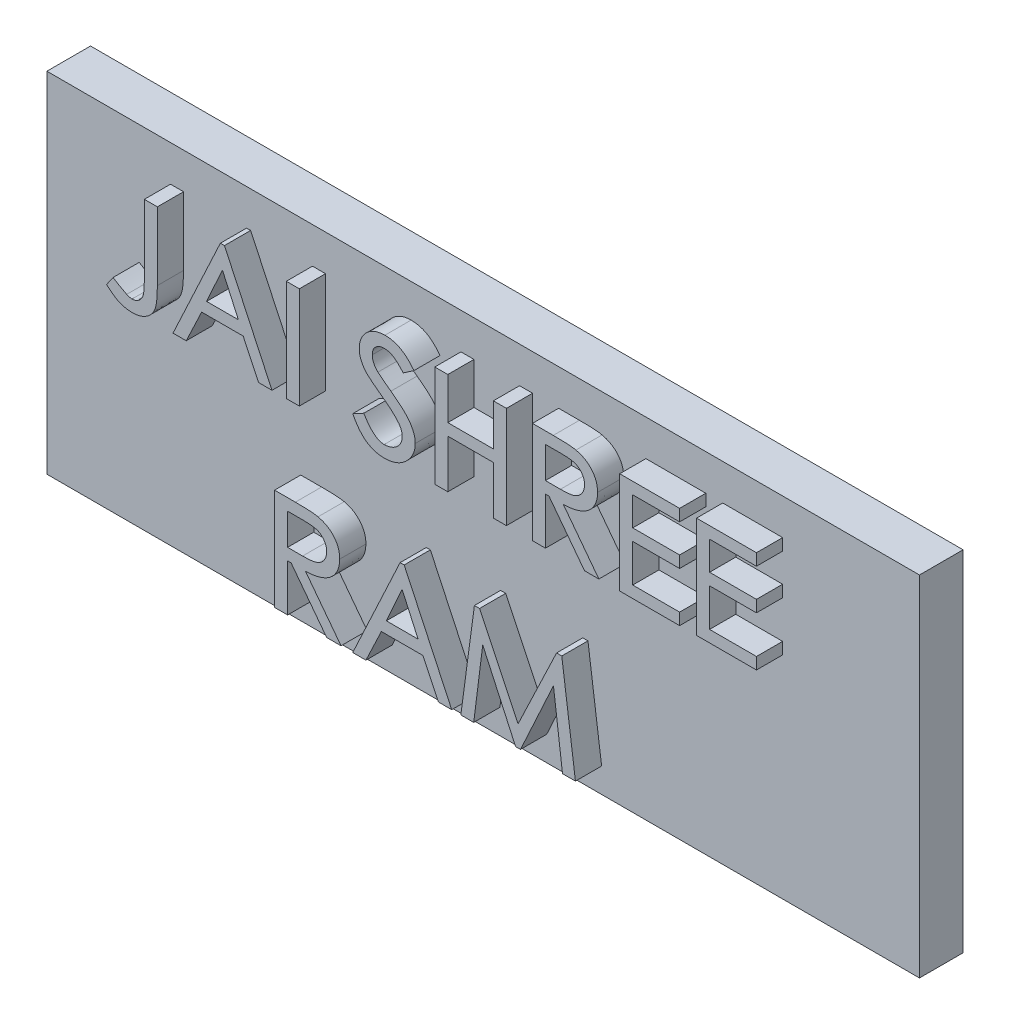
from build123d import *

# Parameters (mm, degrees)
SKETCH1_W           = 50
SKETCH1_H           = 20
BOSS_EXTRUDE4_DEPTH = 2.5
SKETCH3_W           = 0.746260684
SKETCH3_H           = 5.820833333
BOSS_EXTRUDE5_DEPTH = 1.5


with BuildPart() as part:
    # Sketch1 → Boss-Extrude4 (new body)
    with BuildSketch(Plane.XY):
        with Locations((25, 10)):
            Rectangle(SKETCH1_W, SKETCH1_H)
    extrude(amount=BOSS_EXTRUDE4_DEPTH)

    # Sketch3 → Boss-Extrude5 (add)
    # profile 1 of 11: a face of its own
    with BuildSketch(Plane.XY.offset(2.5)):
        with BuildLine():
            Line((7.084742935, 17.934560525), (7.831003619, 17.934560525))
            Line((7.831003619, 17.934560525), (7.831003619, 14.027186226))
            add(Edge.make_bspline(
                [(7.831003619, 14.027186226), (7.830439068, 13.956445674), (7.829353193, 13.820381182), (7.824385638, 13.624356974), (7.812407276, 13.445136284), (7.797069528, 13.281870811), (7.779924351, 13.134469513), (7.754763509, 13.003542974), (7.727850465, 12.888631113), (7.684298502, 12.758299554), (7.615616781, 12.611983995), (7.506225078, 12.454205409), (7.370368081, 12.313654468), (7.238408402, 12.211055476), (7.121050361, 12.140600257), (7.027785467, 12.092003572), (6.928468821, 12.052540147), (6.824004925, 12.021574123), (6.715503014, 11.99561053), (6.601788347, 11.976753661), (6.482875343, 11.966490539), (6.401855443, 11.965154672), (6.360636865, 11.964475055)],
                knots=[0, 0, 0, 0, 1.452672516, 2.794113746, 4.025812556, 5.140045592, 6.161674878, 7.071150553, 7.876425152, 8.583113845, 9.889795866, 11.180512384, 12.507055147, 13.889560834, 14.598589264, 15.316057477, 16.046722018, 16.789019803, 17.55176036, 18.336401437, 19.153650307, 20, 20, 20, 20], degree=3))
            add(Edge.make_bspline(
                [(6.360636865, 11.964475055), (6.302618082, 11.965894514), (6.187170219, 11.968719004), (6.015127725, 11.996262498), (5.845022964, 12.037470153), (5.673788809, 12.098505781), (5.497922922, 12.184117552), (5.31500582, 12.302385703), (5.118396126, 12.448102635), (4.988923861, 12.562000642), (4.920586952, 12.622117282)],
                knots=[0, 0, 0, 0, 0.856854487, 1.704999893, 2.568796624, 3.440919207, 4.38635173, 5.452546826, 6.655425746, 8, 8, 8, 8], degree=3))
            Line((4.920586952, 12.622117282), (5.290219197, 13.158492149))
            add(Edge.make_bspline(
                [(5.290219197, 13.158492149), (5.333285003, 13.131547047), (5.416416614, 13.07953386), (5.537584453, 13.006540858), (5.649041324, 12.939619873), (5.752317223, 12.881679789), (5.845264408, 12.829002065), (5.928868095, 12.783194977), (6.004233394, 12.745716385), (6.051601295, 12.723483702), (6.073792915, 12.713067803)],
                knots=[0, 0, 0, 0, 1.351848167, 2.609525467, 3.764319947, 4.811191365, 5.760578872, 6.607529217, 7.347634558, 8, 8, 8, 8], degree=3))
            add(Edge.make_bspline(
                [(6.073792915, 12.713067803), (6.101546812, 12.701137909), (6.154644422, 12.678314126), (6.234743082, 12.655859605), (6.309389128, 12.638742959), (6.35821799, 12.636962961), (6.381625447, 12.63610967)],
                knots=[0, 0, 0, 0, 1.133394633, 2.168363871, 3.121954873, 4, 4, 4, 4], degree=3))
            add(Edge.make_bspline(
                [(6.381625447, 12.63610967), (6.416362768, 12.637645025), (6.485168475, 12.640686169), (6.585401419, 12.66607081), (6.680168764, 12.707696452), (6.768839346, 12.765024338), (6.848957925, 12.836878261), (6.91750151, 12.922501702), (6.97400698, 13.019734669), (7.008610961, 13.111975929), (7.032375293, 13.196561847), (7.044710554, 13.275717156), (7.058139209, 13.368495016), (7.06847028, 13.47548296), (7.07455324, 13.596887098), (7.080834383, 13.732515402), (7.084096005, 13.882193839), (7.084521509, 13.9867626), (7.084742935, 14.041178614)],
                knots=[0, 0, 0, 0, 0.93789549, 1.85772999, 2.77510142, 3.725098534, 4.6996409, 5.670950193, 6.678238788, 7.725916441, 8.324833892, 9.050260382, 9.888218126, 10.859356959, 11.953767278, 13.173560852, 14.529163492, 16, 16, 16, 16], degree=3))
            Line((7.084742935, 14.041178614), (7.084742935, 17.934560525))
        make_face()
    # profile 2 of 11: a face of its own
    with BuildSketch(Plane.XY.offset(2.5)):
        Polygon((11.67424614, 17.934560525), (14.398097636, 12.113727192), (13.632014403, 12.113727192), (12.748161905, 13.979378901), (10.367123911, 13.979378901), (9.483271414, 12.113727192), (8.726516439, 12.113727192), (11.441039677, 17.934560525), align=None)
        Polygon((11.557642908, 16.662419266), (10.651635797, 14.651013516), (12.472978278, 14.651013516), align=None, mode=Mode.SUBTRACT)
    # profile 3 of 11: a face of its own
    with BuildSketch(Plane.XY.offset(2.5)):
        with Locations((15.59211473, 15.024143859)):
            Rectangle(SKETCH3_W, SKETCH3_H)
    # profile 4 of 11: a face of its own
    with BuildSketch(Plane.XY.offset(2.5)):
        with BuildLine():
            Line((19.024913875, 13.268099187), (19.659235456, 13.606248559))
            add(Edge.make_bspline(
                [(19.659235456, 13.606248559), (19.705462039, 13.529677791), (19.793813844, 13.383329841), (19.938891993, 13.186181776), (20.083138968, 13.018066291), (20.227978656, 12.879153128), (20.375422993, 12.771673646), (20.523966735, 12.693995979), (20.674539587, 12.645172982), (20.776346754, 12.639098294), (20.826433807, 12.63610967)],
                knots=[0, 0, 0, 0, 1.354943589, 2.589672558, 3.704607527, 4.708856974, 5.624398268, 6.459549776, 7.242129862, 8, 8, 8, 8], degree=3))
            add(Edge.make_bspline(
                [(20.826433807, 12.63610967), (20.873192766, 12.637612698), (20.965808813, 12.640589764), (21.10189004, 12.666408256), (21.233652699, 12.705746536), (21.358813587, 12.761763374), (21.474445055, 12.830390872), (21.576522224, 12.912020335), (21.663131855, 13.004436918), (21.73451827, 13.106386925), (21.790475201, 13.215238489), (21.831668091, 13.32790286), (21.855844208, 13.444704666), (21.859072574, 13.523350736), (21.860704474, 13.563105363)],
                knots=[0, 0, 0, 0, 1.0888553, 2.156709112, 3.216967111, 4.287545289, 5.343926646, 6.34269433, 7.323221176, 8.28571565, 9.233736345, 10.167849744, 11.073870434, 12, 12, 12, 12], degree=3))
            add(Edge.make_bspline(
                [(21.860704474, 13.563105363), (21.858418029, 13.60841309), (21.853797649, 13.699969644), (21.816713353, 13.835977998), (21.756444603, 13.970655574), (21.700694652, 14.054743282), (21.671807238, 14.098314198)],
                knots=[0, 0, 0, 0, 0.941861274, 1.903286225, 2.913566088, 4, 4, 4, 4], degree=3))
            add(Edge.make_bspline(
                [(21.671807238, 14.098314198), (21.646828181, 14.13003066), (21.594245145, 14.196796508), (21.50523698, 14.297313531), (21.401085744, 14.402167698), (21.281960388, 14.510885976), (21.149954775, 14.625904415), (21.002826577, 14.744250305), (20.841615884, 14.867923712), (20.728643906, 14.950893506), (20.670185477, 14.993827018)],
                knots=[0, 0, 0, 0, 0.718593868, 1.512701116, 2.388487339, 3.348232282, 4.383172848, 5.504845107, 6.708858268, 8, 8, 8, 8], degree=3))
            add(Edge.make_bspline(
                [(20.670185477, 14.993827018), (20.61057318, 15.03716323), (20.496193875, 15.120313287), (20.335043423, 15.242211655), (20.190556358, 15.354608705), (20.063840664, 15.457592287), (19.954881939, 15.552057488), (19.863909712, 15.637616676), (19.788185343, 15.711921882), (19.747493225, 15.761917912), (19.729197396, 15.78439693)],
                knots=[0, 0, 0, 0, 1.435833971, 2.754963323, 3.936484598, 5.002077172, 5.935979083, 6.744956812, 7.435712417, 8, 8, 8, 8], degree=3))
            add(Edge.make_bspline(
                [(19.729197396, 15.78439693), (19.702487957, 15.818908124), (19.650015115, 15.886708143), (19.583582682, 15.995463762), (19.52641906, 16.10564274), (19.479336341, 16.218265263), (19.44285007, 16.332971542), (19.41774924, 16.450163844), (19.400043551, 16.569376657), (19.398713062, 16.649916269), (19.398044217, 16.690404041)],
                knots=[0, 0, 0, 0, 1.064105702, 2.090521257, 3.104283852, 4.09061442, 5.065433238, 6.036507983, 7.012940167, 8, 8, 8, 8], degree=3))
            add(Edge.make_bspline(
                [(19.398044217, 16.690404041), (19.400150491, 16.753544046), (19.40432076, 16.878556636), (19.441587855, 17.061056291), (19.501979823, 17.234945867), (19.584414217, 17.39932663), (19.689681436, 17.551138782), (19.814892516, 17.687384206), (19.960724935, 17.805155683), (20.123287635, 17.904390619), (20.298511059, 17.984870811), (20.483062389, 18.042233407), (20.67470435, 18.077008643), (20.804912567, 18.081527849), (20.870743035, 18.083812662)],
                knots=[0, 0, 0, 0, 1.004530234, 1.988896367, 2.951881425, 3.928924249, 4.907494835, 5.884204368, 6.865296418, 7.88218147, 8.909671266, 9.927572845, 10.952225504, 12, 12, 12, 12], degree=3))
            add(Edge.make_bspline(
                [(20.870743035, 18.083812662), (20.945489775, 18.081137207), (21.093526054, 18.075838457), (21.311745446, 18.03992968), (21.520416797, 17.975278393), (21.688478542, 17.903915379), (21.819031775, 17.830952315), (21.917771856, 17.765054177), (22.018975346, 17.690476247), (22.119436831, 17.60350087), (22.223071755, 17.508336242), (22.324573176, 17.399809433), (22.430364582, 17.284140249), (22.497792154, 17.200722568), (22.532339089, 17.157983001)],
                knots=[0, 0, 0, 0, 1.360590218, 2.69465552, 4.010645498, 5.328858611, 6.009843139, 6.729980544, 7.488405022, 8.296451933, 9.147430815, 10.048128915, 10.999946711, 12, 12, 12, 12], degree=3))
            Line((22.532339089, 17.157983001), (21.923670219, 16.740543431))
            add(Edge.make_bspline(
                [(21.923670219, 16.740543431), (21.891905439, 16.774459619), (21.830829739, 16.839671936), (21.740988654, 16.932152967), (21.655986736, 17.015148082), (21.57556602, 17.088277606), (21.501529021, 17.15284571), (21.431795367, 17.206675145), (21.368545717, 17.2529391), (21.289478045, 17.298791784), (21.192547044, 17.344203599), (21.073247726, 17.385063816), (20.94810788, 17.40690109), (20.86343316, 17.410405482), (20.820603646, 17.412178046)],
                knots=[0, 0, 0, 0, 1.253377364, 2.409930098, 3.477532466, 4.457083962, 5.341772995, 6.126101147, 6.832963523, 7.453284126, 8.588253012, 9.715448048, 10.844445545, 12, 12, 12, 12], degree=3))
            add(Edge.make_bspline(
                [(20.820603646, 17.412178046), (20.774887712, 17.410041646), (20.686012204, 17.405888308), (20.558347198, 17.370321959), (20.440992194, 17.314199474), (20.337452179, 17.234771128), (20.251392957, 17.136460104), (20.188278844, 17.021301192), (20.151342726, 16.890062304), (20.146717049, 16.797920692), (20.144304901, 16.74987169)],
                knots=[0, 0, 0, 0, 1.033513523, 2.009234674, 2.977584268, 3.963375862, 4.942860848, 5.915719707, 6.913112236, 8, 8, 8, 8], degree=3))
            add(Edge.make_bspline(
                [(20.144304901, 16.74987169), (20.145244749, 16.718737483), (20.147122172, 16.656544377), (20.160912373, 16.564418702), (20.186403553, 16.475403446), (20.218706031, 16.387622379), (20.26391843, 16.301568723), (20.32149912, 16.217106595), (20.389852714, 16.131802643), (20.442311584, 16.07817647), (20.469627918, 16.050252298)],
                knots=[0, 0, 0, 0, 0.940834015, 1.879392378, 2.805520916, 3.734846727, 4.701501436, 5.734192883, 6.820151034, 8, 8, 8, 8], degree=3))
            add(Edge.make_bspline(
                [(20.469627918, 16.050252298), (20.483459341, 16.037240377), (20.515205357, 16.00737529), (20.573430961, 15.961642982), (20.644369783, 15.904306885), (20.729005287, 15.836302823), (20.830120481, 15.76132284), (20.943976778, 15.674357656), (21.073457029, 15.579322345), (21.164572644, 15.512696143), (21.212390505, 15.47773043)],
                knots=[0, 0, 0, 0, 0.485581606, 1.114511607, 1.892484918, 2.819534315, 3.891398566, 5.11240712, 6.484579029, 8, 8, 8, 8], degree=3))
            add(Edge.make_bspline(
                [(21.212390505, 15.47773043), (21.277536948, 15.430245342), (21.403565011, 15.338383784), (21.582592201, 15.199822713), (21.744049442, 15.063998782), (21.892018759, 14.93565057), (22.021496082, 14.809394124), (22.134907379, 14.687825426), (22.233676881, 14.57213108), (22.339163894, 14.424624026), (22.44462976, 14.242773171), (22.538938043, 14.022972244), (22.595214752, 13.801437347), (22.603082089, 13.653575679), (22.606965157, 13.580595848)],
                knots=[0, 0, 0, 0, 1.186540699, 2.295404303, 3.331123753, 4.291760032, 5.17774712, 5.991329992, 6.738459906, 7.414799035, 8.65800623, 9.82461674, 10.926299804, 12, 12, 12, 12], degree=3))
            add(Edge.make_bspline(
                [(22.606965157, 13.580595848), (22.605312926, 13.528817722), (22.60202899, 13.425904738), (22.578219548, 13.273741302), (22.538602732, 13.125843663), (22.481606764, 12.98283634), (22.410516014, 12.843377174), (22.32236824, 12.708685405), (22.217450756, 12.579280052), (22.100189859, 12.454379166), (21.970528912, 12.339590382), (21.831482267, 12.238561114), (21.683474443, 12.154161825), (21.527645975, 12.085686452), (21.364911189, 12.029887528), (21.193661891, 11.991669932), (21.014745058, 11.969610171), (20.892958704, 11.966204797), (20.831097936, 11.964475055)],
                knots=[0, 0, 0, 0, 0.932646097, 1.853705421, 2.767602683, 3.685675702, 4.622099834, 5.5835355, 6.579838097, 7.620108014, 8.666886363, 9.695041649, 10.711275682, 11.730160242, 12.757671447, 13.80585424, 14.885494678, 16, 16, 16, 16], degree=3))
            add(Edge.make_bspline(
                [(20.831097936, 11.964475055), (20.785988362, 11.965476996), (20.697141154, 11.967450406), (20.565240578, 11.979968097), (20.436884887, 12.004026974), (20.31137035, 12.035132679), (20.188618632, 12.074741593), (20.070211662, 12.125408657), (19.954177691, 12.183606781), (19.841182344, 12.251750757), (19.73108153, 12.331541986), (19.623249563, 12.42416391), (19.51831281, 12.531244707), (19.414472434, 12.651393172), (19.313100302, 12.785960727), (19.214433079, 12.934239771), (19.117210962, 13.095752148), (19.05628597, 13.20951784), (19.024913875, 13.268099187)],
                knots=[0, 0, 0, 0, 0.916943493, 1.805999526, 2.689245248, 3.568702553, 4.433092864, 5.307568578, 6.183755457, 7.069823058, 7.986358083, 8.944343836, 9.955449961, 11.030835633, 12.170024038, 13.377301724, 14.649494474, 16, 16, 16, 16], degree=3))
        make_face()
    # profile 5 of 11: a face of its own
    with BuildSketch(Plane.XY.offset(2.5)):
        Polygon((23.726356183, 17.934560525), (24.472616867, 17.934560525), (24.472616867, 15.546526337), (27.08452926, 15.546526337), (27.08452926, 17.934560525), (27.830789944, 17.934560525), (27.830789944, 12.113727192), (27.08452926, 12.113727192), (27.08452926, 14.874891722), (24.472616867, 14.874891722), (24.472616867, 12.113727192), (23.726356183, 12.113727192), align=None)
    # profile 6 of 11: a face of its own
    with BuildSketch(Plane.XY.offset(2.5)):
        with BuildLine():
            Line((29.323311311, 17.934560525), (30.514996341, 17.934560525))
            add(Edge.make_bspline(
                [(30.514996341, 17.934560525), (30.591568239, 17.93437538), (30.738113123, 17.934021047), (30.948393419, 17.930302803), (31.139322333, 17.925378317), (31.311044166, 17.915091781), (31.464018768, 17.906012005), (31.597584499, 17.891078318), (31.712370199, 17.877759086), (31.781382913, 17.863105256), (31.812790311, 17.85643636)],
                knots=[0, 0, 0, 0, 1.411347063, 2.701065231, 3.876524531, 4.931206492, 5.871916627, 6.700262025, 7.408494688, 8, 8, 8, 8], degree=3))
            add(Edge.make_bspline(
                [(31.812790311, 17.85643636), (31.859621134, 17.844663682), (31.951884988, 17.821469714), (32.084809391, 17.775805708), (32.210301926, 17.721971119), (32.328197192, 17.660262043), (32.438778657, 17.590368522), (32.539906939, 17.510182031), (32.63556589, 17.423798572), (32.72206452, 17.328507957), (32.800765191, 17.22717764), (32.868056325, 17.119825479), (32.925792712, 17.007893216), (32.973980226, 16.89154724), (33.010010826, 16.769490126), (33.035248173, 16.642620194), (33.052616734, 16.511314242), (33.053944487, 16.421884847), (33.05461473, 16.376741348)],
                knots=[0, 0, 0, 0, 1.103820101, 2.174693741, 3.209859002, 4.223626675, 5.214778413, 6.196198804, 7.171320727, 8.158999421, 9.134971582, 10.10159085, 11.051641808, 12.012235658, 12.97676874, 13.956376421, 14.968389326, 16, 16, 16, 16], degree=3))
            add(Edge.make_bspline(
                [(33.05461473, 16.376741348), (33.052119662, 16.302289654), (33.04721601, 16.155966924), (33.002651537, 15.942566173), (32.929622896, 15.74140471), (32.846326161, 15.584262195), (32.765293416, 15.467436341), (32.697451235, 15.384382121), (32.622866126, 15.306573136), (32.542066943, 15.233199319), (32.45292733, 15.167503111), (32.358166622, 15.105212824), (32.256666986, 15.047950482), (32.110360699, 14.979192839), (31.912472872, 14.907527985), (31.656786677, 14.846089589), (31.380498381, 14.808770024), (31.189470044, 14.803158016), (31.091016306, 14.800265653)],
                knots=[0, 0, 0, 0, 1.258986715, 2.474334223, 3.670931197, 4.871716255, 5.472099774, 6.075216246, 6.684756624, 7.295006596, 7.919971941, 8.55677058, 9.213641309, 9.890468445, 11.291088691, 12.766994829, 14.333747493, 16, 16, 16, 16], degree=3))
            Line((31.091016306, 14.800265653), (33.129240798, 12.113727192))
            Line((33.129240798, 12.113727192), (32.307188014, 12.113727192))
            Line((32.307188014, 12.113727192), (30.268963521, 14.800265653))
            Line((30.268963521, 14.800265653), (30.069571995, 14.800265653))
            Line((30.069571995, 14.800265653), (30.069571995, 12.113727192))
            Line((30.069571995, 12.113727192), (29.323311311, 12.113727192))
            Line((29.323311311, 12.113727192), (29.323311311, 17.934560525))
        make_face()
        with BuildLine():
            Line((30.069571995, 17.26292591), (30.069571995, 15.470734236))
            Line((30.069571995, 15.470734236), (30.925439717, 15.464904075))
            add(Edge.make_bspline(
                [(30.925439717, 15.464904075), (30.971307952, 15.465022589), (31.059961435, 15.465251651), (31.188285817, 15.469968345), (31.307309779, 15.477866587), (31.416563166, 15.489564351), (31.515729091, 15.503520178), (31.605567691, 15.519150822), (31.685235399, 15.540257181), (31.778297288, 15.57068123), (31.881690217, 15.619560343), (31.991370954, 15.693980824), (32.087509991, 15.782055637), (32.166348981, 15.885256404), (32.229428602, 15.99847901), (32.275317585, 16.119366677), (32.302960763, 16.247238005), (32.306535822, 16.334628075), (32.308354046, 16.379073412)],
                knots=[0, 0, 0, 0, 1.165824803, 2.253289887, 3.263370799, 4.197285623, 5.045371766, 5.808848116, 6.513348392, 7.138183875, 8.296069948, 9.40583476, 10.496436725, 11.595152671, 12.691956992, 13.780050175, 14.870965332, 16, 16, 16, 16], degree=3))
            add(Edge.make_bspline(
                [(32.308354046, 16.379073412), (32.306449805, 16.421947255), (32.302672815, 16.50698591), (32.275809239, 16.63179098), (32.227791412, 16.749532439), (32.164082685, 16.860058938), (32.085144492, 16.959421207), (31.994363768, 17.046976508), (31.889493203, 17.11637627), (31.792943973, 17.163216445), (31.706414668, 17.192592844), (31.629796592, 17.210734473), (31.542587711, 17.226753065), (31.444609842, 17.240832058), (31.336044061, 17.251118316), (31.216619556, 17.257589711), (31.08639526, 17.262674383), (30.99579608, 17.262839952), (30.948760363, 17.26292591)],
                knots=[0, 0, 0, 0, 1.114111647, 2.20979856, 3.297775031, 4.406653707, 5.514151176, 6.585969385, 7.670234779, 8.768154562, 9.365517569, 10.041721951, 10.812428959, 11.669578816, 12.61341719, 13.645562296, 14.777663698, 16, 16, 16, 16], degree=3))
            Line((30.948760363, 17.26292591), (30.069571995, 17.26292591))
        make_face(mode=Mode.SUBTRACT)
    # profile 7 of 11: a face of its own
    with BuildSketch(Plane.XY.offset(2.5)):
        Polygon((34.323257892, 17.934560525), (37.756057038, 17.934560525), (37.756057038, 17.26292591), (35.069518576, 17.26292591), (35.069518576, 15.621152405), (37.756057038, 15.621152405), (37.756057038, 14.94951779), (35.069518576, 14.94951779), (35.069518576, 12.785361807), (37.756057038, 12.785361807), (37.756057038, 12.113727192), (34.323257892, 12.113727192), align=None)
    # profile 8 of 11: a face of its own
    with BuildSketch(Plane.XY.offset(2.5)):
        Polygon((38.726195927, 17.934560525), (42.158995072, 17.934560525), (42.158995072, 17.26292591), (39.47245661, 17.26292591), (39.47245661, 15.621152405), (42.158995072, 15.621152405), (42.158995072, 14.94951779), (39.47245661, 14.94951779), (39.47245661, 12.785361807), (42.158995072, 12.785361807), (42.158995072, 12.113727192), (38.726195927, 12.113727192), align=None)
    # profile 9 of 11: a face of its own
    with BuildSketch(Plane.XY.offset(2.5)):
        with BuildLine():
            Line((14.547349773, 7.233171636), (15.739034802, 7.233171636))
            add(Edge.make_bspline(
                [(15.739034802, 7.233171636), (15.8156067, 7.232986492), (15.962151584, 7.232632158), (16.17243188, 7.228913914), (16.363360794, 7.223989428), (16.535082628, 7.213702892), (16.688057229, 7.204623116), (16.821622961, 7.189689429), (16.93640866, 7.176370197), (17.005421375, 7.161716367), (17.036828772, 7.155047471)],
                knots=[0, 0, 0, 0, 1.411347063, 2.701065231, 3.876524531, 4.931206492, 5.871916627, 6.700262025, 7.408494688, 8, 8, 8, 8], degree=3))
            add(Edge.make_bspline(
                [(17.036828772, 7.155047471), (17.083659595, 7.143274793), (17.175923449, 7.120080825), (17.308847852, 7.074416819), (17.434340387, 7.020582231), (17.552235653, 6.958873154), (17.662817118, 6.888979633), (17.763945401, 6.808793142), (17.859604352, 6.722409683), (17.946102982, 6.627119068), (18.024803653, 6.525788751), (18.092094787, 6.41843659), (18.149831173, 6.306504327), (18.198018687, 6.190158351), (18.234049287, 6.068101237), (18.259286635, 5.941231305), (18.276655195, 5.809925353), (18.277982949, 5.720495958), (18.278653192, 5.675352459)],
                knots=[0, 0, 0, 0, 1.103820101, 2.174693741, 3.209859002, 4.223626675, 5.214778413, 6.196198804, 7.171320727, 8.158999421, 9.134971582, 10.10159085, 11.051641808, 12.012235658, 12.97676874, 13.956376421, 14.968389326, 16, 16, 16, 16], degree=3))
            add(Edge.make_bspline(
                [(18.278653192, 5.675352459), (18.276158123, 5.600900765), (18.271254472, 5.454578035), (18.226689999, 5.241177284), (18.153661358, 5.040015821), (18.070364623, 4.882873306), (17.989331877, 4.766047452), (17.921489697, 4.682993233), (17.846904588, 4.605184247), (17.766105404, 4.53181043), (17.676965792, 4.466114222), (17.582205083, 4.403823935), (17.480705447, 4.346561593), (17.33439916, 4.277803951), (17.136511333, 4.206139096), (16.880825138, 4.1447007), (16.604536843, 4.107381135), (16.413508506, 4.101769127), (16.315054767, 4.098876764)],
                knots=[0, 0, 0, 0, 1.258986715, 2.474334223, 3.670931197, 4.871716255, 5.472099774, 6.075216246, 6.684756624, 7.295006596, 7.919971941, 8.55677058, 9.213641309, 9.890468445, 11.291088691, 12.766994829, 14.333747493, 16, 16, 16, 16], degree=3))
            Line((16.315054767, 4.098876764), (18.35327926, 1.412338303))
            Line((18.35327926, 1.412338303), (17.531226475, 1.412338303))
            Line((17.531226475, 1.412338303), (15.493001983, 4.098876764))
            Line((15.493001983, 4.098876764), (15.293610456, 4.098876764))
            Line((15.293610456, 4.098876764), (15.293610456, 1.412338303))
            Line((15.293610456, 1.412338303), (14.547349773, 1.412338303))
            Line((14.547349773, 1.412338303), (14.547349773, 7.233171636))
        make_face()
        with BuildLine():
            Line((15.293610456, 6.561537021), (15.293610456, 4.769345347))
            Line((15.293610456, 4.769345347), (16.149478178, 4.763515186))
            add(Edge.make_bspline(
                [(16.149478178, 4.763515186), (16.195346413, 4.7636337), (16.283999897, 4.763862762), (16.412324278, 4.768579456), (16.53134824, 4.776477698), (16.640601628, 4.788175462), (16.739767553, 4.802131289), (16.829606153, 4.817761933), (16.909273861, 4.838868292), (17.002335749, 4.869292341), (17.105728679, 4.918171454), (17.215409415, 4.992591935), (17.311548453, 5.080666748), (17.390387442, 5.183867515), (17.453467064, 5.297090121), (17.499356046, 5.417977788), (17.526999224, 5.545849116), (17.530574284, 5.633239186), (17.532392508, 5.677684523)],
                knots=[0, 0, 0, 0, 1.165824803, 2.253289887, 3.263370799, 4.197285623, 5.045371766, 5.808848116, 6.513348392, 7.138183875, 8.296069948, 9.40583476, 10.496436725, 11.595152671, 12.691956992, 13.780050175, 14.870965332, 16, 16, 16, 16], degree=3))
            add(Edge.make_bspline(
                [(17.532392508, 5.677684523), (17.530488267, 5.720558366), (17.526711276, 5.805597021), (17.4998477, 5.930402091), (17.451829873, 6.04814355), (17.388121147, 6.158670049), (17.309182954, 6.258032318), (17.218402229, 6.345587619), (17.113531664, 6.414987381), (17.016982435, 6.461827556), (16.93045313, 6.491203955), (16.853835053, 6.509345584), (16.766626173, 6.525364176), (16.668648304, 6.539443169), (16.560082523, 6.549729427), (16.440658017, 6.556200822), (16.310433721, 6.561285494), (16.219834542, 6.561451063), (16.172798825, 6.561537021)],
                knots=[0, 0, 0, 0, 1.114111647, 2.20979856, 3.297775031, 4.406653707, 5.514151176, 6.585969385, 7.670234779, 8.768154562, 9.365517569, 10.041721951, 10.812428959, 11.669578816, 12.61341719, 13.645562296, 14.777663698, 16, 16, 16, 16], degree=3))
            Line((16.172798825, 6.561537021), (15.293610456, 6.561537021))
        make_face(mode=Mode.SUBTRACT)
    # profile 10 of 11: a face of its own
    with BuildSketch(Plane.XY.offset(2.5)):
        Polygon((21.972643576, 7.233171636), (24.696495072, 1.412338303), (23.930411839, 1.412338303), (23.046559341, 3.277990012), (20.665521347, 3.277990012), (19.78166885, 1.412338303), (19.024913875, 1.412338303), (21.739437112, 7.233171636), align=None)
        Polygon((21.856040344, 5.961030377), (20.950033233, 3.949624628), (22.771375714, 3.949624628), align=None, mode=Mode.SUBTRACT)
    # profile 11 of 11: a face of its own
    with BuildSketch(Plane.XY.offset(2.5)):
        Polygon((25.218877551, 1.412338303), (25.996621107, 7.233171636), (26.290461251, 7.233171636), (28.49776043, 2.606355397), (30.705059608, 7.233171636), (31.003563882, 7.233171636), (31.785971568, 1.412338303), (31.045541045, 1.412338303), (30.527822696, 5.516772063), (28.63885034, 1.412338303), (28.356670519, 1.412338303), (26.473528325, 5.516772063), (25.95814204, 1.412338303), align=None)
    extrude(amount=BOSS_EXTRUDE5_DEPTH)


solid = part.part
